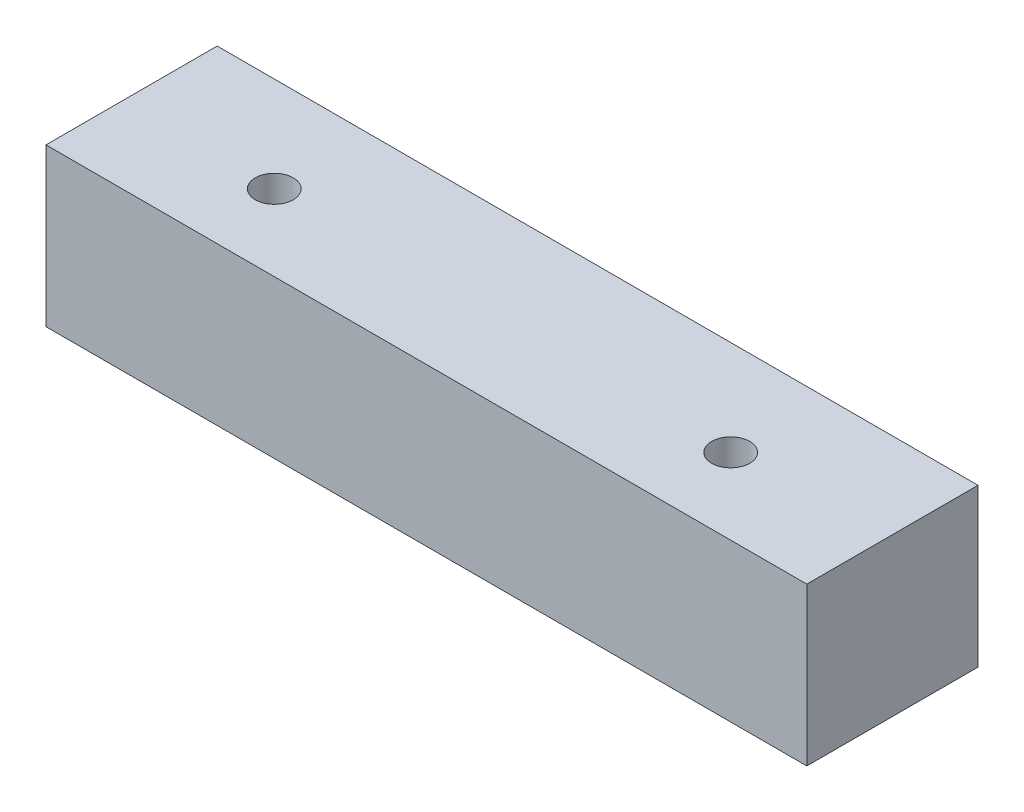
from build123d import *

# Parameters (mm, degrees)
SKETCH1_W               = 40
SKETCH1_H               = 9
BOSS_EXTRUDE1_DEPTH     = 8.28
CUT_EXTRUDE1_DEPTH      = 5
CUT_EXTRUDE1_DEPTH_BACK = 10
SKETCH2_R               = 1
SKETCH3_R               = 1.75
CUT_EXTRUDE6_DEPTH      = 3.8
SKETCH4_W               = 3.5
SKETCH4_H               = 0.5
CUT_EXTRUDE7_DEPTH      = 2.5


with BuildPart() as part:
    # Sketch1 → Boss-Extrude1 (new body)
    with BuildSketch(Plane(origin=(0, 0, 0), x_dir=(1, 0, 0), z_dir=(0, 1, 0))):
        with Locations((20, 4.5)):
            Rectangle(SKETCH1_W, SKETCH1_H)
    extrude(amount=BOSS_EXTRUDE1_DEPTH)

    # Sketch2 → Cut-Extrude1 (cut, two sides: drawn at the far end of the back side and taken through both)
    with BuildSketch(Plane(origin=(0, 8.28, 0), x_dir=(1, 0, 0), z_dir=(0, 1, 0)).offset(-CUT_EXTRUDE1_DEPTH_BACK)):
        with Locations(Location((8, 4, 0), (0, 0, 90))):
            Circle(SKETCH2_R)
        with Locations(Location((32, 4, 0), (0, 0, 90))):
            Circle(SKETCH2_R)
    extrude(amount=CUT_EXTRUDE1_DEPTH + CUT_EXTRUDE1_DEPTH_BACK, mode=Mode.SUBTRACT)

    # Sketch3 → Cut-Extrude6 (cut)
    with BuildSketch(Plane(origin=(0, 0, -9), x_dir=(-1, 0, 0), z_dir=(0, 0, -1))):
        with Locations((-32, 4.78)):
            Circle(SKETCH3_R)
        with Locations((-8, 4.78)):
            Circle(SKETCH3_R)
    extrude(amount=-CUT_EXTRUDE6_DEPTH, mode=Mode.SUBTRACT)

    # Sketch4 → Cut-Extrude7 (cut)
    with BuildSketch(Plane(origin=(0, 0, -5.2), x_dir=(-1, 0, 0), z_dir=(0, 0, -1))):
        Polygon((-30.25, 5.03), (-33.25, 5.03), (-34.25, 4.53), (-30.25, 4.53), align=None)
        with Locations((-8, 4.78)):
            Rectangle(SKETCH4_W, SKETCH4_H)
    extrude(amount=-CUT_EXTRUDE7_DEPTH, mode=Mode.SUBTRACT)


solid = part.part
